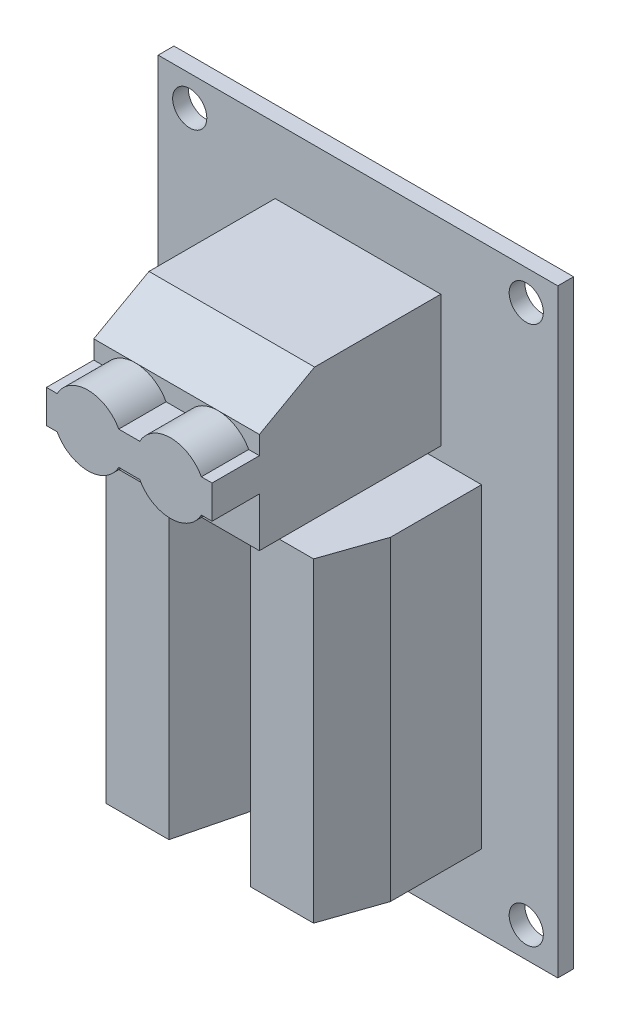
from build123d import *

# Parameters (mm, degrees)
SKETCH1_W               = 57
SKETCH1_H               = 38
BOSS_EXTRUDE1_DEPTH     = 1.5
SKETCH2_R               = 1.625
CUT_EXTRUDE1_DEPTH      = 35.285565476
SKETCH3_W               = 23.5
SKETCH3_H               = 30
BOSS_EXTRUDE2_DEPTH     = 14.1
SKETCH4_W               = 3.25
SKETCH4_H               = 30
CUT_EXTRUDE2_DEPTH      = 14.1
CUT_EXTRUDE3_DEPTH      = 56.716783827
SKETCH6_W               = 15.75
SKETCH6_H               = 12.5
BOSS_EXTRUDE3_DEPTH     = 21.75
SKETCH8_OUTSIDE_W       = 54.468
SKETCH8_OUTSIDE_H       = 73.468
CUT_EXTRUDE4_DEPTH      = 4.5
CUT_EXTRUDE5_DEPTH      = 42.398218561
CUT_EXTRUDE5_DEPTH_BACK = 42.398218561


with BuildPart() as part:
    # Sketch1 → Boss-Extrude1 (new body)
    with BuildSketch(Plane(origin=(0, 0, 0), x_dir=(0, 1, 0), z_dir=(0, 0, 1))):
        Rectangle(SKETCH1_W, SKETCH1_H)
    extrude(amount=BOSS_EXTRUDE1_DEPTH)

    # Sketch2 → Cut-Extrude1 (cut, through all)
    with BuildSketch(Plane.XY.offset(1.5)):
        with Locations((-16, 25.625)):
            Circle(SKETCH2_R)
        with Locations(Location((-16, -25.625, 0), (0, 0, 180))):
            Circle(SKETCH2_R)
        with Locations(Location((16, 25.625, 0), (0, 0, 180))):
            Circle(SKETCH2_R)
        with Locations((16, -25.625)):
            Circle(SKETCH2_R)
    extrude(amount=-CUT_EXTRUDE1_DEPTH, mode=Mode.SUBTRACT)

    # Sketch3 → Boss-Extrude2 (add)
    with BuildSketch(Plane.XY.offset(1.5)):
        with Locations((0, -6.5)):
            Rectangle(SKETCH3_W, SKETCH3_H)
    extrude(amount=BOSS_EXTRUDE2_DEPTH)

    # Sketch4 → Cut-Extrude2 (cut)
    with BuildSketch(Plane.XY.offset(15.6)):
        with Locations((0, -6.5)):
            Rectangle(SKETCH4_W, SKETCH4_H)
    extrude(amount=-CUT_EXTRUDE2_DEPTH, mode=Mode.SUBTRACT)

    # Sketch5 → Cut-Extrude3 (cut, through all)
    with BuildSketch(Plane.XZ.offset(21.5)):
        Polygon((-11.75, 10.164296274), (-9.875, 15.6), (-11.75, 15.6), align=None)
        Polygon((-1.625, 15.6), (-3.875, 15.6), (-1.625, 6.6), align=None)
        Polygon((1.625, 6.6), (1.625, 15.6), (3.875, 15.6), align=None)
        Polygon((11.75, 15.6), (11.75, 10.164296274), (9.875, 15.6), align=None)
    extrude(amount=-CUT_EXTRUDE3_DEPTH, mode=Mode.SUBTRACT)


with BuildPart() as body_2:
    # Sketch6 → Boss-Extrude3 (new body)
    with BuildSketch(Plane.XY.offset(1.5)):
        with Locations((0, 16)):
            Rectangle(SKETCH6_W, SKETCH6_H)
    extrude(amount=BOSS_EXTRUDE3_DEPTH)

    # Sketch8 outside → Cut-Extrude4 (cut)
    with BuildSketch(Plane.XY.offset(23.25)):
        Rectangle(SKETCH8_OUTSIDE_W, SKETCH8_OUTSIDE_H)
        with BuildLine():
            Line((-1, 17.575), (1, 17.575))
            ThreePointArc((1, 17.575), (3.928310093, 19.325), (6.856620186, 17.575))
            Line((6.856620186, 17.575), (7.875, 17.575))
            Line((7.875, 17.575), (7.875, 14.425))
            Line((7.875, 14.425), (6.856620186, 14.425))
            ThreePointArc((6.856620186, 14.425), (3.928310093, 12.675), (1, 14.425))
            Line((1, 14.425), (-1, 14.425))
            ThreePointArc((-1, 14.425), (-3.928310093, 12.675), (-6.856620186, 14.425))
            Line((-6.856620186, 14.425), (-7.875, 14.425))
            Line((-7.875, 14.425), (-7.875, 17.575))
            Line((-7.875, 17.575), (-6.856620186, 17.575))
            ThreePointArc((-6.856620186, 17.575), (-3.928310093, 19.325), (-1, 17.575))
        make_face(mode=Mode.SUBTRACT)
    extrude(amount=-CUT_EXTRUDE4_DEPTH, mode=Mode.SUBTRACT)

    # Sketch9 → Cut-Extrude5 (cut, two sides: drawn at the far end of the back side and taken through both)
    with BuildSketch(Plane.YZ.offset(-CUT_EXTRUDE5_DEPTH_BACK)):
        Polygon((19.325, 18.75), (22.25, 13.5), (22.25, 18.75), align=None)
    extrude(amount=CUT_EXTRUDE5_DEPTH + CUT_EXTRUDE5_DEPTH_BACK, mode=Mode.SUBTRACT)


solid = Compound([part.part, body_2.part])
